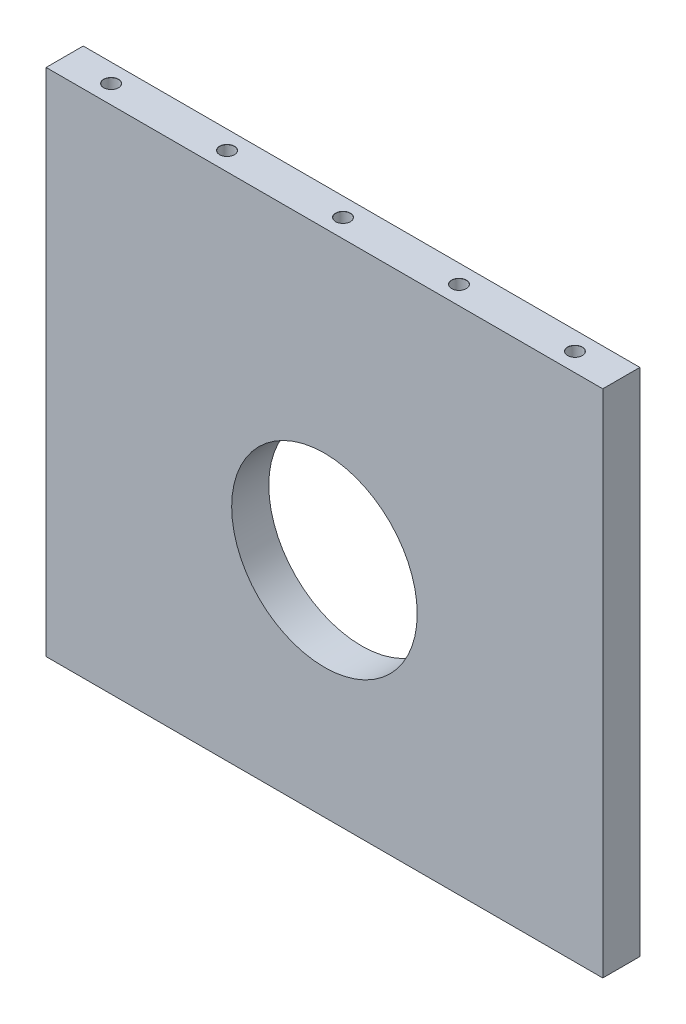
from build123d import *

# Parameters (mm, degrees)
SKETCH1_W                              = 120
SKETCH1_H                              = 110
BOSS_EXTRUDE1_DEPTH                    = 8
TAP_DRILL_FOR_M3_HELICOIL1_D           = 3.15
TAP_DRILL_FOR_M3_HELICOIL1_DEPTH       = 6
TAP_DRILL_FOR_M3_HELICOIL1_CSINK_D     = 3.2
TAP_DRILL_FOR_M3_HELICOIL1_CSINK_ANGLE = 90
TAP_DRILL_FOR_M3_HELICOIL1_TIP         = 0.946355475
F_40_0_40_DIAMETER_HOLE1_D             = 40


with BuildPart() as part:
    # Sketch1 → Boss-Extrude1 (new body)
    with BuildSketch(Plane.XY):
        with Locations((60, 55)):
            Rectangle(SKETCH1_W, SKETCH1_H)
    extrude(amount=BOSS_EXTRUDE1_DEPTH)

    # Tap Drill for M3 Helicoil1
    with Locations(Plane(origin=(0, 110, 0), x_dir=(1, 0, 0), z_dir=(0, 1, 0))):
        with Locations((10, -4), (60, -4), (85, -4), (110, -4), (35, -4)):
            CounterSinkHole(TAP_DRILL_FOR_M3_HELICOIL1_D / 2, TAP_DRILL_FOR_M3_HELICOIL1_CSINK_D / 2, depth=TAP_DRILL_FOR_M3_HELICOIL1_DEPTH, counter_sink_angle=TAP_DRILL_FOR_M3_HELICOIL1_CSINK_ANGLE)
            with Locations((0, 0, -(TAP_DRILL_FOR_M3_HELICOIL1_DEPTH + TAP_DRILL_FOR_M3_HELICOIL1_TIP / 2))):  # 118° drill point
                Cone(0, TAP_DRILL_FOR_M3_HELICOIL1_D / 2, TAP_DRILL_FOR_M3_HELICOIL1_TIP, mode=Mode.SUBTRACT)

    # Ø40.0 (40) Diameter Hole1 (through all)
    with Locations(Plane(origin=(0, 0, 0), x_dir=(-1, 0, 0), z_dir=(0, 0, -1))):
        with Locations((-60, 48)):
            Hole(F_40_0_40_DIAMETER_HOLE1_D / 2)


solid = part.part
